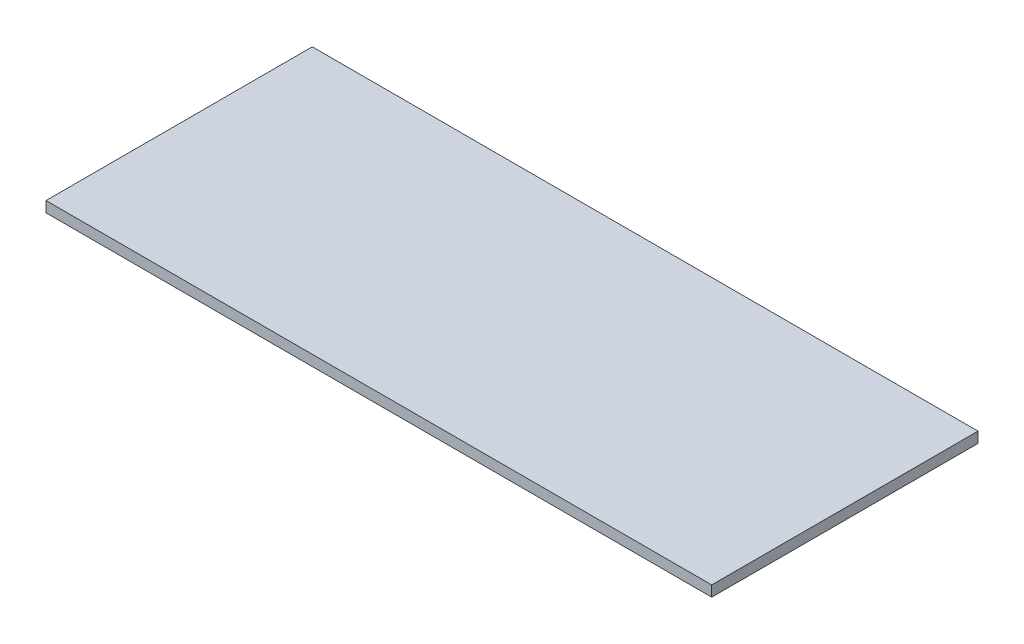
from build123d import *

# Parameters (mm, degrees)
SKETCH_1_W      = 1250
SKETCH_1_H      = 500
EXTRUDE_1_DEPTH = 20


with BuildPart() as part:
    # Эскиз1 → Бобышка-Вытянуть1 (new body)
    with BuildSketch(Plane(origin=(0, 0, 0), x_dir=(1, 0, 0), z_dir=(0, 1, 0))):
        with Locations((625, 250)):
            Rectangle(SKETCH_1_W, SKETCH_1_H)
    extrude(amount=EXTRUDE_1_DEPTH)


solid = part.part
